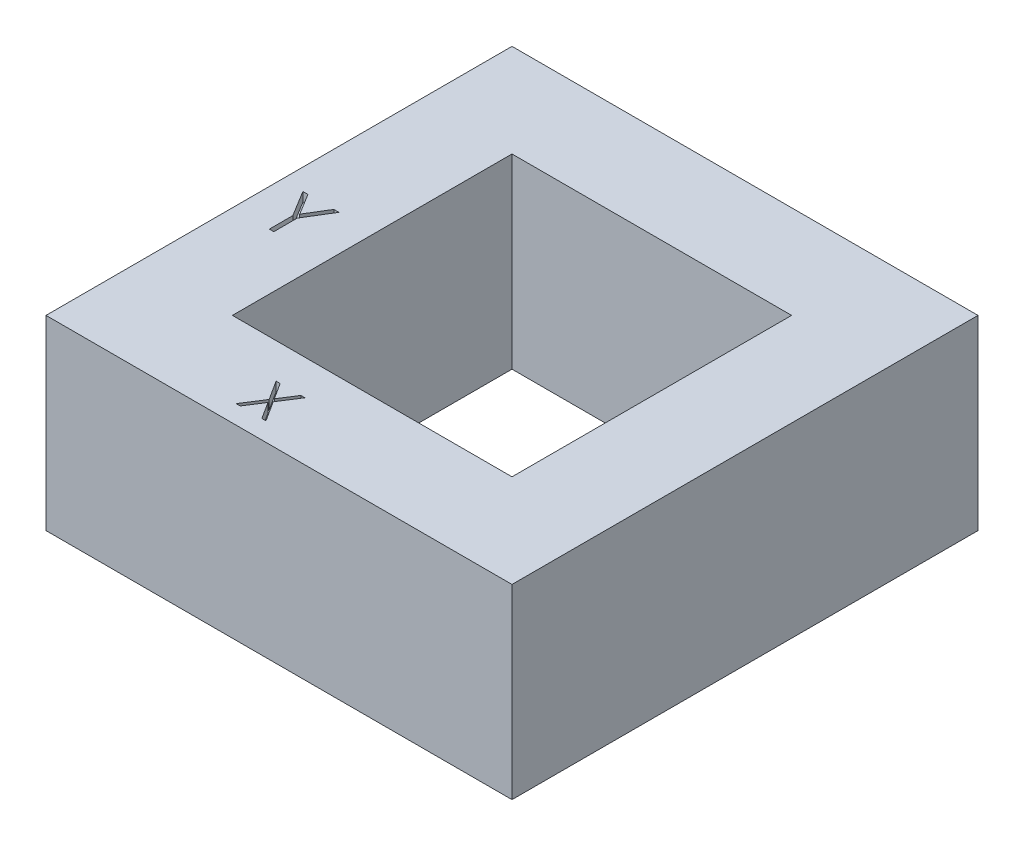
from build123d import *

# Parameters (mm, degrees)
SKETCH1_W           = 25
SKETCH1_H           = 25
SKETCH1_W_2         = 15
SKETCH1_H_2         = 15
BOSS_EXTRUDE1_DEPTH = 10
CUT_EXTRUDE1_DEPTH  = 0.5


with BuildPart() as part:
    # Sketch1 → Boss-Extrude1 (new body)
    with BuildSketch(Plane(origin=(0, 0, 0), x_dir=(1, 0, 0), z_dir=(0, 1, 0))):
        Rectangle(SKETCH1_W, SKETCH1_H)
        Rectangle(SKETCH1_W_2, SKETCH1_H_2, mode=Mode.SUBTRACT)
    extrude(amount=BOSS_EXTRUDE1_DEPTH)

    # Sketch2 → Cut-Extrude1 (cut)
    with BuildSketch(Plane(origin=(0, 10, 0), x_dir=(1, 0, 0), z_dir=(0, 1, 0))):
        Polygon((-3.273397436, -9.383333333), (-3.05418336, -9.383333333), (-2.5, -10.249165331), (-1.94581664, -9.383333333), (-1.726602564, -9.383333333), (-2.390180956, -10.420466079), (-1.699465812, -11.5), (-1.918679888, -11.5), (-2.5, -10.591766827), (-3.081320112, -11.5), (-3.300534188, -11.5), (-2.609395032, -10.420466079), align=None)
        Polygon((-11.364316239, 0.145833333), (-11.092418703, 0.145833333), (-10.39703943, -0.991048177), (-9.702720186, 0.145833333), (-9.43082265, 0.145833333), (-10.278846154, -1.24227514), (-10.278846154, -2.5), (-10.516292735, -2.5), (-10.516292735, -1.24227514), align=None)
    extrude(amount=-CUT_EXTRUDE1_DEPTH, mode=Mode.SUBTRACT)


solid = part.part
